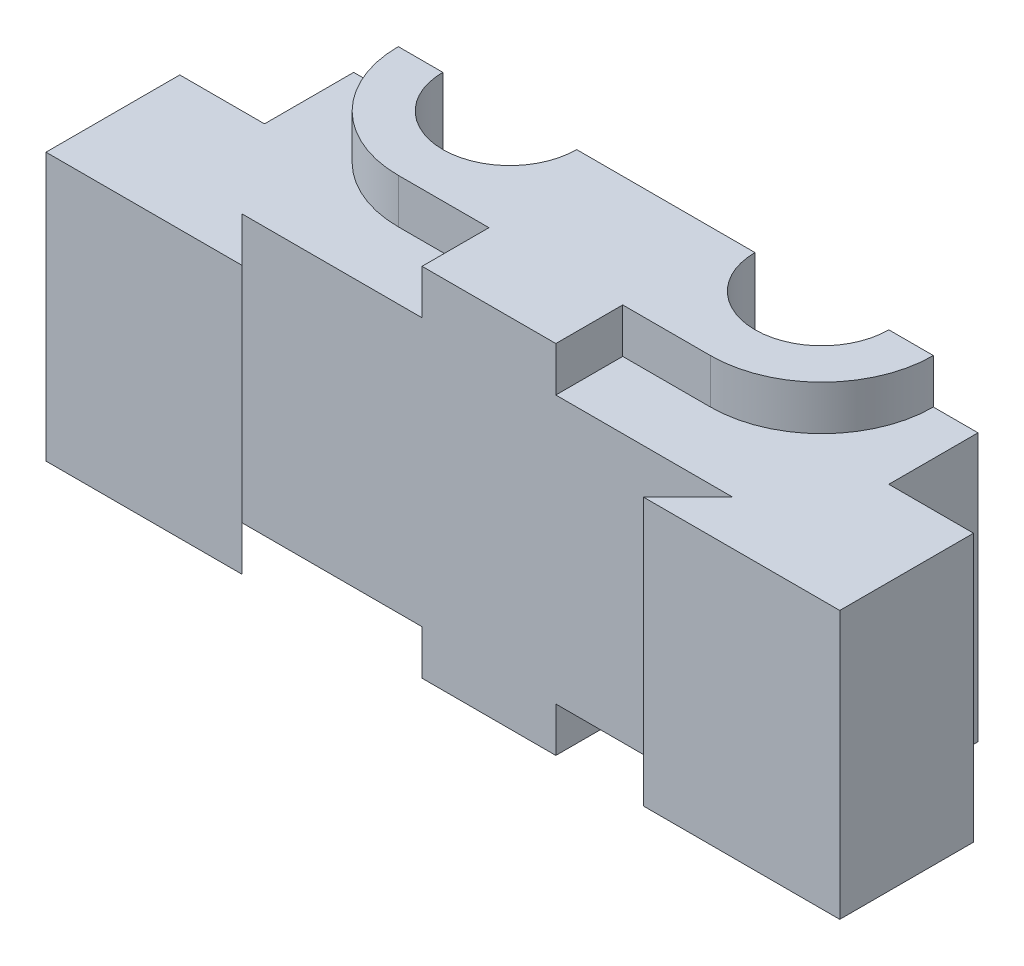
from build123d import *

# Parameters (mm, degrees)
BOSS_EXTRUDE1_DEPTH = 15
BOSS_EXTRUDE2_DEPTH = 20
SKETCH3_R           = 2.25
CUT_EXTRUDE1_DEPTH  = 15


with BuildPart() as part:
    # Sketch1 → Boss-Extrude1 (new, symmetric)
    with BuildSketch(Plane(origin=(0, 0, 0), x_dir=(1, 0, 0), z_dir=(0, 1, 0))):
        with BuildLine():
            Line((0, 0), (-27.5, 0))
            Line((-27.5, 0), (-22.5, -5))
            Line((-22.5, -5), (-44.5, -5))
            Line((-44.5, -5), (-44.5, 10))
            Line((-44.5, 10), (-35, 10))
            Line((-35, 10), (-35, 20))
            Line((-35, 20), (-25, 20))
            ThreePointArc((-25, 20), (-17.5, 12.5), (-10, 20))
            Line((-10, 20), (10, 20))
            ThreePointArc((10, 20), (17.5, 12.5), (25, 20))
            Line((25, 20), (35, 20))
            Line((35, 20), (35, 10))
            Line((35, 10), (44.5, 10))
            Line((44.5, 10), (44.5, -5))
            Line((44.5, -5), (22.5, -5))
            Line((22.5, -5), (27.5, 0))
            Line((27.5, 0), (0, 0))
        make_face()
    extrude(amount=BOSS_EXTRUDE1_DEPTH, both=True)

    # Sketch2 → Boss-Extrude2 (add, symmetric)
    with BuildSketch(Plane(origin=(0, 0, 0), x_dir=(1, 0, 0), z_dir=(0, 1, 0))):
        with BuildLine():
            Line((-30, 20), (-25, 20))
            ThreePointArc((-25, 20), (-17.5, 12.5), (-10, 20))
            Line((-10, 20), (5, 20))
            Line((5, 20), (10, 20))
            ThreePointArc((10, 20), (17.5, 12.5), (25, 20))
            Line((25, 20), (30, 20))
            ThreePointArc((30, 20), (26.338834765, 11.161165235), (17.5, 7.5))
            Line((17.5, 7.5), (7.664635512, 7.5))
            Line((7.664635512, 7.5), (7.664635512, 0))
            Line((7.664635512, 0), (-7.335364488, 0))
            Line((-7.335364488, 0), (-7.335364488, 7.5))
            Line((-7.335364488, 7.5), (-17.5, 7.5))
            ThreePointArc((-17.5, 7.5), (-26.338834765, 11.161165235), (-30, 20))
        make_face()
    extrude(amount=BOSS_EXTRUDE2_DEPTH, both=True)

    # Sketch3 → Cut-Extrude1 (cut)
    with BuildSketch(Plane(origin=(0, 0, -20), x_dir=(-1, 0, 0), z_dir=(0, 0, -1))):
        with Locations((0, 15)):
            Circle(SKETCH3_R)
        with Locations((-30, 7.5)):
            Circle(SKETCH3_R)
        with Locations((-30, -7.5)):
            Circle(SKETCH3_R)
        with Locations(Location((30, -7.5, 0), (0, 0, 180))):
            Circle(SKETCH3_R)
        with Locations(Location((30, 7.5, 0), (0, 0, 180))):
            Circle(SKETCH3_R)
        with Locations(Location((0, -15, 0), (0, 0, 180))):
            Circle(SKETCH3_R)
    extrude(amount=-CUT_EXTRUDE1_DEPTH, mode=Mode.SUBTRACT)


solid = part.part
